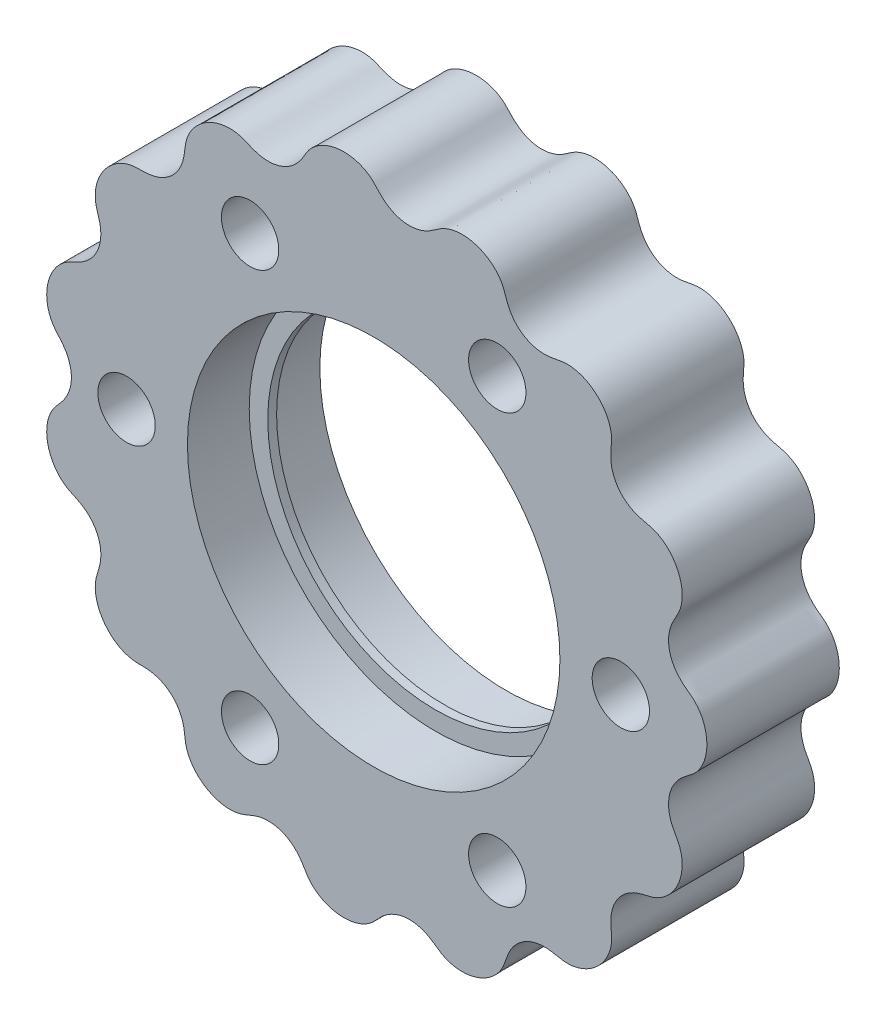
from build123d import *

# Parameters (mm, degrees)
LOBEBASE_DEPTH      = 7.5
LOBEBASE_DEPTH_BACK = 7.5
SKETCH4_R           = 21.1
CUT_EXTRUDE1_DEPTH  = 7
CUT_EXTRUDE2_START  = -7
SKETCH5_R           = 21.1
CUT_EXTRUDE2_DEPTH  = 7
SKETCH6_R           = 19
CUT_EXTRUDE3_DEPTH  = 56.333581379
SKETCH7_R           = 4.1
CUT_EXTRUDE4_DEPTH  = 5
SKETCH8_R           = 3.25
CUT_EXTRUDE5_DEPTH  = 32
CIRPATTERN1_COUNT   = 6


with BuildPart() as part:
    # LobeBaseSketch → LobeBase (new, two sides: drawn at the far end of the back side and taken through both)
    with BuildSketch(Plane.XY.offset(-LOBEBASE_DEPTH_BACK)):
        with BuildLine():
            add(Edge.make_bspline(
                [(37.75, 0), (37.75, 0.091408208), (37.745431022, 0.273870688), (37.724960683, 0.545998683), (37.691185975, 0.814669547), (37.644613685, 1.07822502), (37.585939314, 1.335090295), (37.516033044, 1.583800342), (37.435921645, 1.823025014), (37.346766209, 2.051592696), (37.249835561, 2.268512363), (37.146475055, 2.472993938), (37.038070263, 2.664467038), (36.92600482, 2.842598332), (36.811611208, 3.007308039), (36.696112656, 3.158786542), (36.580553327, 3.297512757), (36.465712469, 3.424277111), (36.351995924, 3.540213908), (36.239294879, 3.646851346), (36.126796411, 3.746193712), (36.012722585, 3.840861808), (35.893964269, 3.934339571), (35.765565167, 4.031416565), (35.620014788, 4.138994755), (35.446381301, 4.267567909), (35.22964363, 4.433878295), (34.951701851, 4.665260078), (34.598406594, 5.004694966), (34.180160085, 5.509113655), (33.762947862, 6.222046747), (33.46535546, 7.113280892), (33.374722063, 8.048505531), (33.465888381, 8.869497817), (33.642810015, 9.5004234), (33.827500686, 9.954210728), (33.987301686, 10.278637611), (34.117656872, 10.518724861), (34.223983543, 10.706805384), (34.313194439, 10.864283623), (34.391008085, 11.005192489), (34.461478373, 11.138892034), (34.527185015, 11.271773648), (34.589551299, 11.408284664), (34.649135474, 11.551542457), (34.705864963, 11.703708676), (34.759217599, 11.866223661), (34.808361264, 12.039958578), (34.852262584, 12.22531857), (34.889772875, 12.422316449), (34.919697227, 12.630628605), (34.940850806, 12.849640187), (34.952105178, 13.078483907), (34.952426554, 13.316075129), (34.940907246, 13.56114488), (34.916791211, 13.812271733), (34.879494276, 14.067913109), (34.828619462, 14.326436231), (34.763967698, 14.586148793), (34.685544143, 14.845329252), (34.593560301, 15.102256583), (34.488432059, 15.355239264), (34.370773813, 15.602643228), (34.241388801, 15.842918485), (34.101255784, 16.074624121), (33.951512212, 16.296451369), (33.793433987, 16.507244458), (33.628411942, 16.706018951), (33.457925097, 16.891977321), (33.283510701, 17.064521506), (33.106730971, 17.223262236), (32.929136301, 17.368024944), (32.75222447, 17.498852124), (32.577395069, 17.616002036), (32.405897831, 17.719943768), (32.238772795, 17.811348773), (32.07677906, 17.891079263), (31.920307008, 17.960174278), (31.769266032, 18.019835126), (31.62293515, 18.071413629), (31.479756505, 18.116410146), (31.337039897, 18.15649575), (31.190527945, 18.193588578), (31.033744758, 18.230048204), (30.857021878, 18.269125099), (30.646104382, 18.315959418), (30.380460139, 18.379736363), (30.032436239, 18.478065034), (29.571624355, 18.644456107), (28.984371592, 18.935149328), (28.313253249, 19.416750616), (27.678891478, 20.109891787), (27.215703619, 20.927398084), (26.965060549, 21.71449254), (26.87006595, 22.362832252), (26.854217339, 22.852508067), (26.868246515, 23.213883695), (26.889679622, 23.486234543), (26.910314629, 23.701301603), (26.927760666, 23.881450473), (26.94153417, 24.041826789), (26.951531478, 24.19263025), (26.957509661, 24.340748943), (26.958960064, 24.490824615), (26.955124722, 24.645932188), (26.945058112, 24.808016909), (26.927697371, 24.978182207), (26.901927986, 25.156885481), (26.866641137, 25.344076535), (26.820782237, 25.539299862), (26.763391305, 25.741773817), (26.693636026, 25.950454788), (26.61083828, 26.164091494), (26.514494815, 26.381272591), (26.404292556, 26.600469625), (26.280118968, 26.820076546), (26.142067808, 27.038446533), (25.990440526, 27.253926506), (25.825743584, 27.464889496), (25.648681913, 27.669764893), (25.460148731, 27.86706649), (25.261211977, 28.055418161), (25.053097563, 28.233577009), (24.837169721, 28.400453753), (24.614908668, 28.555130151), (24.387885837, 28.696873229), (24.15773692, 28.82514609), (23.92613291, 28.939615113), (23.694749345, 29.04015329), (23.465233823, 29.126839521), (23.239171832, 29.1999536), (23.018050729, 29.259966655), (22.803221522, 29.307526707), (22.595857755, 29.343438953), (22.39691032, 29.368640239), (22.207056239, 29.38416699), (22.026638286, 29.391115628), (21.855590479, 29.390594148), (21.693341429, 29.383663146), (21.538682649, 29.371264321), (21.389580715, 29.354134684), (21.242898322, 29.332706631), (21.093965982, 29.307000836), (20.935907947, 29.276538895), (20.758569559, 29.240357743), (20.546837604, 29.197355148), (20.278219092, 29.147571039), (19.920289566, 29.095844677), (19.431639616, 29.060421407), (18.776921937, 29.087125662), (17.967939932, 29.254121909), (17.106495704, 29.629319699), (16.350842772, 30.187753389), (15.801728778, 30.804854233), (15.451243375, 31.358504248), (15.237595852, 31.799399153), (15.103427432, 32.135238397), (15.012232479, 32.392760907), (14.943607842, 32.597627456), (14.886272444, 32.769297581), (14.833624241, 32.921410825), (14.781419943, 33.063242912), (14.726635985, 33.200987618), (14.666919719, 33.338678498), (14.600328026, 33.478816343), (14.525205925, 33.622793644), (14.440133637, 33.77118613), (14.343906963, 33.923958341), (14.235533361, 34.080613423), (14.11423469, 34.240306312), (13.979451889, 34.401932479), (13.830849072, 34.564200004), (13.668315691, 34.725689969), (13.491966046, 34.884908357), (13.302135807, 35.040331514), (13.099375408, 35.190446471), (12.884440322, 35.333786915), (12.658278306, 35.468965294), (12.422013786, 35.594701294), (12.176929568, 35.709846813), (11.924446148, 35.813407437), (11.666098853, 35.904560383), (11.403513144, 35.982668831), (11.138378358, 36.047292557), (10.872420223, 36.098194763), (10.607372444, 36.135345004), (10.344947673, 36.158918096), (10.086808136, 36.169288914), (9.83453617, 36.167022935), (9.589604841, 36.152862374), (9.353348761, 36.127707713), (9.126935074, 36.092594312), (8.911334411, 36.04866367), (8.707291357, 35.997128698), (8.515293546, 35.939232006), (8.335537914, 35.876195787), (8.167891646, 35.809161092), (8.011843804, 35.739113286), (7.866441014, 35.666788866), (7.730196245, 35.592556582), (7.600952102, 35.51626266), (7.475666642, 35.437026056), (7.350065668, 35.352966403), (7.218062456, 35.260850041), (7.070771977, 35.155666894), (6.894835943, 35.030262924), (6.669689743, 34.875525885), (6.363743857, 34.682688448), (5.931747856, 34.45157584), (5.322771896, 34.20967372), (4.515806567, 34.033189758), (3.576231416, 34.025569062), (2.658772668, 34.228371886), (1.906134546, 34.568776776), (1.360760451, 34.932005976), (0.986255612, 35.247885238), (0.727088535, 35.50011844), (0.539033959, 35.69828463), (0.393015501, 35.857527381), (0.270812478, 35.991035437), (0.160845922, 36.108583847), (0.055466615, 36.216920505), (-0.05060684, 36.320473912), (-0.16116429, 36.421971997), (-0.278998025, 36.522909007), (-0.406186323, 36.623883905), (-0.544260388, 36.724845169), (-0.694305885, 36.825270614), (-0.857027459, 36.924302638), (-1.032792258, 37.020852737), (-1.221661758, 37.113684484), (-1.423417335, 37.201481034), (-1.637582853, 37.282901176), (-1.863446223, 37.356626547), (-2.100081069, 37.421401753), (-2.346369164, 37.476068506), (-2.601023947, 37.519594542), (-2.862615229, 37.551097757), (-3.129595047, 37.569865871), (-3.400324522, 37.575371805), (-3.673101505, 37.567284884), (-3.946188746, 37.545477932), (-4.217842295, 37.510030319), (-4.486339812, 37.461226998), (-4.75000845, 37.399553559), (-5.007252009, 37.325687348), (-5.256577007, 37.240484669), (-5.4966174, 37.144964074), (-5.726157652, 37.040285746), (-5.944153937, 36.927726884), (-6.149753283, 36.808652953), (-6.342310572, 36.684484522), (-6.521403376, 36.556659194), (-6.686844819, 36.426587867), (-6.838694841, 36.295604062), (-6.977270643, 36.164904408), (-7.103157662, 36.035477287), (-7.217223449, 35.908015056), (-7.320638516, 35.782802768), (-7.414911317, 35.659572463), (-7.501950183, 35.537306168), (-7.584175715, 35.41396174), (-7.664727773, 35.286082908), (-7.747851608, 35.14823988), (-7.839626316, 34.992241859), (-7.949345491, 34.80612), (-8.092089555, 34.573185471), (-8.293150978, 34.272580304), (-8.593796996, 33.885739828), (-9.051733762, 33.417058407), (-9.717150779, 32.927609916), (-10.572395774, 32.538488421), (-11.493023385, 32.350593928), (-12.319047664, 32.355443766), (-12.965010318, 32.465446524), (-13.435617182, 32.601691747), (-13.774970575, 32.726705497), (-14.027368429, 32.831250633), (-14.22553279, 32.917335067), (-14.391473425, 32.989596298), (-14.539744119, 33.052254685), (-14.680077395, 33.108363522), (-14.819099283, 33.159820305), (-14.96138153, 33.207575653), (-15.110082783, 33.251858903), (-15.267345266, 33.292371921), (-15.434546846, 33.328444844), (-15.612466937, 33.359159051), (-15.801400445, 33.38344448), (-16.001240042, 33.4001574), (-16.211538989, 33.408143274), (-16.431561954, 33.406288027), (-16.660328445, 33.393560064), (-16.896651711, 33.369044634), (-17.139174849, 33.331971666), (-17.386405191, 33.281737837), (-17.636747545, 33.217923418), (-17.888536585, 33.140304277), (-18.140068464, 33.048859327), (-18.389631612, 32.94377365), (-18.635536538, 32.825437486), (-18.87614446, 32.694441256), (-19.109894484, 32.551566798), (-19.335329071, 32.397774967), (-19.551117511, 32.23418978), (-19.756077101, 32.062079257), (-19.949191768, 31.882833124), (-20.129627853, 31.697937494), (-20.296746796, 31.508946652), (-20.450114497, 31.317451938), (-20.589507116, 31.125047701), (-20.714913101, 30.933294089), (-20.826531274, 30.743676236), (-20.924764778, 30.557559069), (-21.010210763, 30.376136441), (-21.083645718, 30.200372509), (-21.14600648, 30.030932087), (-21.198367202, 29.868094809), (-21.241913141, 29.711644995), (-21.277913349, 29.560724307), (-21.307697128, 29.413626593), (-21.33264519, 29.267501714), (-21.354220151, 29.117915114), (-21.374091742, 28.958179733), (-21.394481998, 28.778340312), (-21.419012872, 28.563682724), (-21.454673055, 28.292827202), (-21.516084668, 27.936431669), (-21.633396276, 27.460751557), (-21.86111242, 26.846330111), (-22.269924477, 26.128547182), (-22.892959687, 25.425207529), (-23.657571284, 24.879104385), (-24.414154619, 24.54756059), (-25.049013019, 24.385316428), (-25.534349708, 24.318369577), (-25.89521213, 24.29454786), (-26.168311381, 24.287395138), (-26.384357227, 24.285436475), (-26.565342831, 24.283956257), (-26.726280312, 24.280890419), (-26.877302658, 24.275069706), (-27.025234832, 24.26553252), (-27.174639982, 24.251287798), (-27.328496957, 24.231260311), (-27.488641513, 24.20430638), (-27.656059937, 24.169253626), (-27.831090621, 24.12494583), (-28.013567743, 24.070285492), (-28.202928056, 24.004271418), (-28.398293852, 23.926030589), (-28.598540235, 23.834844334), (-28.802351895, 23.730169047), (-29.008272617, 23.611651755), (-29.214749594, 23.479140866), (-29.420173811, 23.332692341), (-29.622917269, 23.17257156), (-29.821367453, 22.999251117), (-30.013959247, 22.813404766), (-30.199204331, 22.615897746), (-30.375718006, 22.407773737), (-30.542243313, 22.190238668), (-30.697672308, 21.964641656), (-30.841064278, 21.73245332), (-30.971660737, 21.49524175), (-31.088896983, 21.254646388), (-31.19241004, 21.012350085), (-31.282042778, 20.770049555), (-31.357844029, 20.529424432), (-31.420064478, 20.292105042), (-31.469148118, 20.05963894), (-31.505718966, 19.833456089), (-31.530562712, 19.614832359), (-31.544602811, 19.404850701), (-31.548870372, 19.20435887), (-31.544466911, 19.013921841), (-31.532518673, 18.833765906), (-31.514120685, 18.663709627), (-31.490268007, 18.503073881), (-31.46177086, 18.350558368), (-31.429149665, 18.204063765), (-31.392506512, 18.060424755), (-31.351373867, 17.914995269), (-31.304557236, 17.760987232), (-31.25003738, 17.588402282), (-31.185138341, 17.382325213), (-31.107548674, 17.120382078), (-31.018691851, 16.769820204), (-30.932384806, 16.287549869), (-30.890506139, 15.633627448), (-30.972025917, 14.811621269), (-31.255122894, 13.915677275), (-31.731510185, 13.105791674), (-32.287832445, 12.49518118), (-32.801813806, 12.088743588), (-33.217961196, 11.830180381), (-33.537936258, 11.66164219), (-33.784515564, 11.544028381), (-33.981086605, 11.454365291), (-34.145823122, 11.379399568), (-34.291599838, 11.311139614), (-34.42719812, 11.244395805), (-34.558461762, 11.175513717), (-34.689156308, 11.101731967), (-34.821565736, 11.020856677), (-34.956901916, 10.931096377), (-35.095589017, 10.830978885), (-35.2374659, 10.719310306), (-35.381934683, 10.595155471), (-35.528073594, 10.457828835), (-35.674725717, 10.306889853), (-35.820571099, 10.142139523), (-35.964187041, 9.963616219), (-36.104099656, 9.771589782), (-36.238828726, 9.56655331), (-36.366927104, 9.349212368), (-36.487015481, 9.120471562), (-36.59781297, 8.881418498), (-36.698163808, 8.633305268), (-36.787060271, 8.377527663), (-36.863661875, 8.11560234), (-36.92731083, 7.849142222), (-36.977543711, 7.579830428), (-37.014099289, 7.30939306), (-37.036922453, 7.039571142), (-37.046164144, 6.772092065), (-37.042177242, 6.508640825), (-37.025508318, 6.250831358), (-36.996885151, 6.000178224), (-36.957199868, 5.758068836), (-36.907487523, 5.525736369), (-36.848899801, 5.30423335), (-36.782673411, 5.094405773), (-36.710092445, 4.896867359), (-36.632443681, 4.711973184), (-36.550963201, 4.539791351), (-36.466771923, 4.380070502), (-36.380796404, 4.232199496), (-36.293669455, 4.095153197), (-36.205602367, 3.967414178), (-36.1162167, 3.846852934), (-36.024318265, 3.730536282), (-35.927590223, 3.614409989), (-35.822180391, 3.492758686), (-35.702177401, 3.357269712), (-35.559070084, 3.195405759), (-35.381646524, 2.987667358), (-35.157885418, 2.703554477), (-34.882882991, 2.298082841), (-34.578650715, 1.717728571), (-34.318782704, 0.93363148), (-34.212991408, 0), (-34.318782704, -0.93363148), (-34.578650715, -1.717728571), (-34.882882991, -2.298082841), (-35.157885418, -2.703554477), (-35.381646524, -2.987667358), (-35.559070084, -3.195405759), (-35.702177401, -3.357269712), (-35.822180391, -3.492758686), (-35.927590223, -3.614409989), (-36.024318265, -3.730536282), (-36.1162167, -3.846852934), (-36.205602367, -3.967414178), (-36.293669455, -4.095153197), (-36.380796404, -4.232199496), (-36.466771923, -4.380070502), (-36.550963201, -4.539791351), (-36.632443681, -4.711973184), (-36.710092445, -4.896867359), (-36.782673411, -5.094405773), (-36.848899801, -5.30423335), (-36.907487523, -5.525736369), (-36.957199868, -5.758068836), (-36.996885151, -6.000178224), (-37.025508318, -6.250831358), (-37.042177242, -6.508640825), (-37.046164144, -6.772092065), (-37.036922453, -7.039571142), (-37.014099289, -7.30939306), (-36.977543711, -7.579830428), (-36.92731083, -7.849142222), (-36.863661875, -8.11560234), (-36.787060271, -8.377527663), (-36.698163808, -8.633305268), (-36.59781297, -8.881418498), (-36.487015481, -9.120471562), (-36.366927104, -9.349212368), (-36.238828726, -9.56655331), (-36.104099656, -9.771589782), (-35.964187041, -9.963616219), (-35.820571099, -10.142139523), (-35.674725717, -10.306889853), (-35.528073594, -10.457828835), (-35.381934683, -10.595155471), (-35.2374659, -10.719310306), (-35.095589017, -10.830978885), (-34.956901916, -10.931096377), (-34.821565736, -11.020856677), (-34.689156308, -11.101731967), (-34.558461762, -11.175513717), (-34.42719812, -11.244395805), (-34.291599838, -11.311139614), (-34.145823122, -11.379399568), (-33.981086605, -11.454365291), (-33.784515564, -11.544028381), (-33.537936258, -11.66164219), (-33.217961196, -11.830180381), (-32.801813806, -12.088743588), (-32.287832445, -12.49518118), (-31.731510185, -13.105791674), (-31.255122894, -13.915677275), (-30.972025917, -14.811621269), (-30.890506139, -15.633627448), (-30.932384806, -16.287549869), (-31.018691851, -16.769820204), (-31.107548674, -17.120382078), (-31.185138341, -17.382325213), (-31.25003738, -17.588402282), (-31.304557236, -17.760987232), (-31.351373867, -17.914995269), (-31.392506512, -18.060424755), (-31.429149665, -18.204063765), (-31.46177086, -18.350558368), (-31.490268007, -18.503073881), (-31.514120685, -18.663709627), (-31.532518673, -18.833765906), (-31.544466911, -19.013921841), (-31.548870372, -19.20435887), (-31.544602811, -19.404850701), (-31.530562712, -19.614832359), (-31.505718966, -19.833456089), (-31.469148118, -20.05963894), (-31.420064478, -20.292105042), (-31.357844029, -20.529424432), (-31.282042778, -20.770049555), (-31.19241004, -21.012350085), (-31.088896983, -21.254646388), (-30.971660737, -21.49524175), (-30.841064278, -21.73245332), (-30.697672308, -21.964641656), (-30.542243313, -22.190238668), (-30.375718006, -22.407773737), (-30.199204331, -22.615897746), (-30.013959247, -22.813404766), (-29.821367453, -22.999251117), (-29.622917269, -23.17257156), (-29.420173811, -23.332692341), (-29.214749594, -23.479140866), (-29.008272617, -23.611651755), (-28.802351895, -23.730169047), (-28.598540235, -23.834844334), (-28.398293852, -23.926030589), (-28.202928056, -24.004271418), (-28.013567743, -24.070285492), (-27.831090621, -24.12494583), (-27.656059937, -24.169253626), (-27.488641513, -24.20430638), (-27.328496957, -24.231260311), (-27.174639982, -24.251287798), (-27.025234832, -24.26553252), (-26.877302658, -24.275069706), (-26.726280312, -24.280890419), (-26.565342831, -24.283956257), (-26.384357227, -24.285436475), (-26.168311381, -24.287395138), (-25.89521213, -24.29454786), (-25.534349708, -24.318369577), (-25.049013019, -24.385316428), (-24.414154619, -24.54756059), (-23.657571284, -24.879104385), (-22.892959687, -25.425207529), (-22.269924477, -26.128547182), (-21.86111242, -26.846330111), (-21.633396276, -27.460751557), (-21.516084668, -27.936431669), (-21.454673055, -28.292827202), (-21.419012872, -28.563682724), (-21.394481998, -28.778340312), (-21.374091742, -28.958179733), (-21.354220151, -29.117915114), (-21.33264519, -29.267501714), (-21.307697128, -29.413626593), (-21.277913349, -29.560724307), (-21.241913141, -29.711644995), (-21.198367202, -29.868094809), (-21.14600648, -30.030932087), (-21.083645718, -30.200372509), (-21.010210763, -30.376136441), (-20.924764778, -30.557559069), (-20.826531274, -30.743676236), (-20.714913101, -30.933294089), (-20.589507116, -31.125047701), (-20.450114497, -31.317451938), (-20.296746796, -31.508946652), (-20.129627853, -31.697937494), (-19.949191768, -31.882833124), (-19.756077101, -32.062079257), (-19.551117511, -32.23418978), (-19.335329071, -32.397774967), (-19.109894484, -32.551566798), (-18.87614446, -32.694441256), (-18.635536538, -32.825437486), (-18.389631612, -32.94377365), (-18.140068464, -33.048859327), (-17.888536585, -33.140304277), (-17.636747545, -33.217923418), (-17.386405191, -33.281737837), (-17.139174849, -33.331971666), (-16.896651711, -33.369044634), (-16.660328445, -33.393560064), (-16.431561954, -33.406288027), (-16.211538989, -33.408143274), (-16.001240042, -33.4001574), (-15.801400445, -33.38344448), (-15.612466937, -33.359159051), (-15.434546846, -33.328444844), (-15.267345266, -33.292371921), (-15.110082783, -33.251858903), (-14.96138153, -33.207575653), (-14.819099283, -33.159820305), (-14.680077395, -33.108363522), (-14.539744119, -33.052254685), (-14.391473425, -32.989596298), (-14.22553279, -32.917335067), (-14.027368429, -32.831250633), (-13.774970575, -32.726705497), (-13.435617182, -32.601691747), (-12.965010318, -32.465446524), (-12.319047664, -32.355443766), (-11.493023385, -32.350593928), (-10.572395774, -32.538488421), (-9.717150779, -32.927609916), (-9.051733762, -33.417058407), (-8.593796996, -33.885739828), (-8.293150978, -34.272580304), (-8.092089555, -34.573185471), (-7.949345491, -34.80612), (-7.839626316, -34.992241859), (-7.747851608, -35.14823988), (-7.664727773, -35.286082908), (-7.584175715, -35.41396174), (-7.501950183, -35.537306168), (-7.414911317, -35.659572463), (-7.320638516, -35.782802768), (-7.217223449, -35.908015056), (-7.103157662, -36.035477287), (-6.977270643, -36.164904408), (-6.838694841, -36.295604062), (-6.686844819, -36.426587867), (-6.521403376, -36.556659194), (-6.342310572, -36.684484522), (-6.149753283, -36.808652953), (-5.944153937, -36.927726884), (-5.726157652, -37.040285746), (-5.4966174, -37.144964074), (-5.256577007, -37.240484669), (-5.007252009, -37.325687348), (-4.75000845, -37.399553559), (-4.486339812, -37.461226998), (-4.217842295, -37.510030319), (-3.946188746, -37.545477932), (-3.673101505, -37.567284884), (-3.400324522, -37.575371805), (-3.129595047, -37.569865871), (-2.862615229, -37.551097757), (-2.601023947, -37.519594542), (-2.346369164, -37.476068506), (-2.100081069, -37.421401753), (-1.863446223, -37.356626547), (-1.637582853, -37.282901176), (-1.423417335, -37.201481034), (-1.221661758, -37.113684484), (-1.032792258, -37.020852737), (-0.857027459, -36.924302638), (-0.694305885, -36.825270614), (-0.544260388, -36.724845169), (-0.406186323, -36.623883905), (-0.278998025, -36.522909007), (-0.16116429, -36.421971997), (-0.05060684, -36.320473912), (0.055466615, -36.216920505), (0.160845922, -36.108583847), (0.270812478, -35.991035437), (0.393015501, -35.857527381), (0.539033959, -35.69828463), (0.727088535, -35.50011844), (0.986255612, -35.247885238), (1.360760451, -34.932005976), (1.906134546, -34.568776776), (2.658772668, -34.228371886), (3.576231416, -34.025569062), (4.515806567, -34.033189758), (5.322771896, -34.20967372), (5.931747856, -34.45157584), (6.363743857, -34.682688448), (6.669689743, -34.875525885), (6.894835943, -35.030262924), (7.070771977, -35.155666894), (7.218062456, -35.260850041), (7.350065668, -35.352966403), (7.475666642, -35.437026056), (7.600952102, -35.51626266), (7.730196245, -35.592556582), (7.866441014, -35.666788866), (8.011843804, -35.739113286), (8.167891646, -35.809161092), (8.335537914, -35.876195787), (8.515293546, -35.939232006), (8.707291357, -35.997128698), (8.911334411, -36.04866367), (9.126935074, -36.092594312), (9.353348761, -36.127707713), (9.589604841, -36.152862374), (9.83453617, -36.167022935), (10.086808136, -36.169288914), (10.344947673, -36.158918096), (10.607372444, -36.135345004), (10.872420223, -36.098194763), (11.138378358, -36.047292557), (11.403513144, -35.982668831), (11.666098853, -35.904560383), (11.924446148, -35.813407437), (12.176929568, -35.709846813), (12.422013786, -35.594701294), (12.658278306, -35.468965294), (12.884440322, -35.333786915), (13.099375408, -35.190446471), (13.302135807, -35.040331514), (13.491966046, -34.884908357), (13.668315691, -34.725689969), (13.830849072, -34.564200004), (13.979451889, -34.401932479), (14.11423469, -34.240306312), (14.235533361, -34.080613423), (14.343906963, -33.923958341), (14.440133637, -33.77118613), (14.525205925, -33.622793644), (14.600328026, -33.478816343), (14.666919719, -33.338678498), (14.726635985, -33.200987618), (14.781419943, -33.063242912), (14.833624241, -32.921410825), (14.886272444, -32.769297581), (14.943607842, -32.597627456), (15.012232479, -32.392760907), (15.103427432, -32.135238397), (15.237595852, -31.799399153), (15.451243375, -31.358504248), (15.801728778, -30.804854233), (16.350842772, -30.187753389), (17.106495704, -29.629319699), (17.967939932, -29.254121909), (18.776921937, -29.087125662), (19.431639616, -29.060421407), (19.920289566, -29.095844677), (20.278219092, -29.147571039), (20.546837604, -29.197355148), (20.758569559, -29.240357743), (20.935907947, -29.276538895), (21.093965982, -29.307000836), (21.242898322, -29.332706631), (21.389580715, -29.354134684), (21.538682649, -29.371264321), (21.693341429, -29.383663146), (21.855590479, -29.390594148), (22.026638286, -29.391115628), (22.207056239, -29.38416699), (22.39691032, -29.368640239), (22.595857755, -29.343438953), (22.803221522, -29.307526707), (23.018050729, -29.259966655), (23.239171832, -29.1999536), (23.465233823, -29.126839521), (23.694749345, -29.04015329), (23.92613291, -28.939615113), (24.15773692, -28.82514609), (24.387885837, -28.696873229), (24.614908668, -28.555130151), (24.837169721, -28.400453753), (25.053097563, -28.233577009), (25.261211977, -28.055418161), (25.460148731, -27.86706649), (25.648681913, -27.669764893), (25.825743584, -27.464889496), (25.990440526, -27.253926506), (26.142067808, -27.038446533), (26.280118968, -26.820076546), (26.404292556, -26.600469625), (26.514494815, -26.381272591), (26.61083828, -26.164091494), (26.693636026, -25.950454788), (26.763391305, -25.741773817), (26.820782237, -25.539299862), (26.866641137, -25.344076535), (26.901927986, -25.156885481), (26.927697371, -24.978182207), (26.945058112, -24.808016909), (26.955124722, -24.645932188), (26.958960064, -24.490824615), (26.957509661, -24.340748943), (26.951531478, -24.19263025), (26.94153417, -24.041826789), (26.927760666, -23.881450473), (26.910314629, -23.701301603), (26.889679622, -23.486234543), (26.868246515, -23.213883695), (26.854217339, -22.852508067), (26.87006595, -22.362832252), (26.965060549, -21.71449254), (27.215703619, -20.927398084), (27.678891478, -20.109891787), (28.313253249, -19.416750616), (28.984371592, -18.935149328), (29.571624355, -18.644456107), (30.032436239, -18.478065034), (30.380460139, -18.379736363), (30.646104382, -18.315959418), (30.857021878, -18.269125099), (31.033744758, -18.230048204), (31.190527945, -18.193588578), (31.337039897, -18.15649575), (31.479756505, -18.116410146), (31.62293515, -18.071413629), (31.769266032, -18.019835126), (31.920307008, -17.960174278), (32.07677906, -17.891079263), (32.238772795, -17.811348773), (32.405897831, -17.719943768), (32.577395069, -17.616002036), (32.75222447, -17.498852124), (32.929136301, -17.368024944), (33.106730971, -17.223262236), (33.283510701, -17.064521506), (33.457925097, -16.891977321), (33.628411942, -16.706018951), (33.793433987, -16.507244458), (33.951512212, -16.296451369), (34.101255784, -16.074624121), (34.241388801, -15.842918485), (34.370773813, -15.602643228), (34.488432059, -15.355239264), (34.593560301, -15.102256583), (34.685544143, -14.845329252), (34.763967698, -14.586148793), (34.828619462, -14.326436231), (34.879494276, -14.067913109), (34.916791211, -13.812271733), (34.940907246, -13.56114488), (34.952426554, -13.316075129), (34.952105178, -13.078483907), (34.940850806, -12.849640187), (34.919697227, -12.630628605), (34.889772875, -12.422316449), (34.852262584, -12.22531857), (34.808361264, -12.039958578), (34.759217599, -11.866223661), (34.705864963, -11.703708676), (34.649135474, -11.551542457), (34.589551299, -11.408284664), (34.527185015, -11.271773648), (34.461478373, -11.138892034), (34.391008085, -11.005192489), (34.313194439, -10.864283623), (34.223983543, -10.706805384), (34.117656872, -10.518724861), (33.987301686, -10.278637611), (33.827500686, -9.954210728), (33.642810015, -9.5004234), (33.465888381, -8.869497817), (33.374722063, -8.048505531), (33.46535546, -7.113280892), (33.762947862, -6.222046747), (34.180160085, -5.509113655), (34.598406594, -5.004694966), (34.951701851, -4.665260078), (35.22964363, -4.433878295), (35.446381301, -4.267567909), (35.620014788, -4.138994755), (35.765565167, -4.031416565), (35.893964269, -3.934339571), (36.012722585, -3.840861808), (36.126796411, -3.746193712), (36.239294879, -3.646851346), (36.351995924, -3.540213908), (36.465712469, -3.424277111), (36.580553327, -3.297512757), (36.696112656, -3.158786542), (36.811611208, -3.007308039), (36.92600482, -2.842598332), (37.038070263, -2.664467038), (37.146475055, -2.472993938), (37.249835561, -2.268512363), (37.346766209, -2.051592696), (37.435921645, -1.823025014), (37.516033044, -1.583800342), (37.585939314, -1.335090295), (37.644613685, -1.07822502), (37.691185975, -0.814669547), (37.724960683, -0.545998683), (37.745431022, -0.273870688), (37.75, -0.091408208), (37.75, 0)],
                knots=[0, 0, 0, 0, 0.001063028, 0.002121941, 0.003172652, 0.004211139, 0.005233476, 0.006235865, 0.007214682, 0.008166516, 0.009088218, 0.009976968, 0.010830339, 0.011646392, 0.012423789, 0.013161937, 0.013861189, 0.0145231, 0.015150802, 0.01574951, 0.016327272, 0.016896058, 0.017473404, 0.018084918, 0.018768139, 0.019578457, 0.020597772, 0.021945216, 0.023782783, 0.026288616, 0.029542917, 0.033333333, 0.037123749, 0.040378051, 0.042883884, 0.04472145, 0.046068895, 0.047088209, 0.047898528, 0.048581749, 0.049193263, 0.049770609, 0.050339395, 0.050917157, 0.051515865, 0.052143566, 0.052805478, 0.053504729, 0.054242878, 0.055020274, 0.055836328, 0.056689699, 0.057578448, 0.058500151, 0.059451984, 0.060430802, 0.061433191, 0.062455527, 0.063494015, 0.064544726, 0.065603638, 0.066666667, 0.067729695, 0.068788608, 0.069839319, 0.070877806, 0.071900142, 0.072902532, 0.073881349, 0.074833182, 0.075754885, 0.076643635, 0.077497006, 0.078313059, 0.079090456, 0.079828604, 0.080527855, 0.081189767, 0.081817469, 0.082416177, 0.082993938, 0.083562724, 0.084140071, 0.084751584, 0.085434805, 0.086245124, 0.087264438, 0.088611883, 0.09044945, 0.092955282, 0.096209584, 0.1, 0.103790416, 0.107044718, 0.10955055, 0.111388117, 0.112735562, 0.113754876, 0.114565195, 0.115248416, 0.115859929, 0.116437276, 0.117006062, 0.117583823, 0.118182531, 0.118810233, 0.119472145, 0.120171396, 0.120909544, 0.121686941, 0.122502994, 0.123356365, 0.124245115, 0.125166818, 0.126118651, 0.127097468, 0.128099858, 0.129122194, 0.130160681, 0.131211392, 0.132270305, 0.133333333, 0.134396362, 0.135455274, 0.136505985, 0.137544473, 0.138566809, 0.139569198, 0.140548016, 0.141499849, 0.142421552, 0.143310301, 0.144163672, 0.144979726, 0.145757122, 0.146495271, 0.147194522, 0.147856434, 0.148484135, 0.149082843, 0.149660605, 0.150229391, 0.150806737, 0.151418251, 0.152101472, 0.152911791, 0.153931105, 0.15527855, 0.157116116, 0.159621949, 0.162876251, 0.166666667, 0.170457083, 0.173711384, 0.176217217, 0.178054784, 0.179402228, 0.180421543, 0.181231861, 0.181915082, 0.182526596, 0.183103942, 0.183672728, 0.18425049, 0.184849198, 0.1854769, 0.186138811, 0.186838063, 0.187576211, 0.188353608, 0.189169661, 0.190023032, 0.190911782, 0.191833484, 0.192785318, 0.193764135, 0.194766524, 0.195788861, 0.196827348, 0.197878059, 0.198936972, 0.2, 0.201063028, 0.202121941, 0.203172652, 0.204211139, 0.205233476, 0.206235865, 0.207214682, 0.208166516, 0.209088218, 0.209976968, 0.210830339, 0.211646392, 0.212423789, 0.213161937, 0.213861189, 0.2145231, 0.215150802, 0.21574951, 0.216327272, 0.216896058, 0.217473404, 0.218084918, 0.218768139, 0.219578457, 0.220597772, 0.221945216, 0.223782783, 0.226288616, 0.229542917, 0.233333333, 0.237123749, 0.240378051, 0.242883884, 0.24472145, 0.246068895, 0.247088209, 0.247898528, 0.248581749, 0.249193263, 0.249770609, 0.250339395, 0.250917157, 0.251515865, 0.252143566, 0.252805478, 0.253504729, 0.254242878, 0.255020274, 0.255836328, 0.256689699, 0.257578448, 0.258500151, 0.259451984, 0.260430802, 0.261433191, 0.262455527, 0.263494015, 0.264544726, 0.265603638, 0.266666667, 0.267729695, 0.268788608, 0.269839319, 0.270877806, 0.271900142, 0.272902532, 0.273881349, 0.274833182, 0.275754885, 0.276643635, 0.277497006, 0.278313059, 0.279090456, 0.279828604, 0.280527855, 0.281189767, 0.281817469, 0.282416177, 0.282993938, 0.283562724, 0.284140071, 0.284751584, 0.285434805, 0.286245124, 0.287264438, 0.288611883, 0.29044945, 0.292955282, 0.296209584, 0.3, 0.303790416, 0.307044718, 0.30955055, 0.311388117, 0.312735562, 0.313754876, 0.314565195, 0.315248416, 0.315859929, 0.316437276, 0.317006062, 0.317583823, 0.318182531, 0.318810233, 0.319472145, 0.320171396, 0.320909544, 0.321686941, 0.322502994, 0.323356365, 0.324245115, 0.325166818, 0.326118651, 0.327097468, 0.328099858, 0.329122194, 0.330160681, 0.331211392, 0.332270305, 0.333333333, 0.334396362, 0.335455274, 0.336505985, 0.337544473, 0.338566809, 0.339569198, 0.340548016, 0.341499849, 0.342421552, 0.343310301, 0.344163672, 0.344979726, 0.345757122, 0.346495271, 0.347194522, 0.347856434, 0.348484135, 0.349082843, 0.349660605, 0.350229391, 0.350806737, 0.351418251, 0.352101472, 0.352911791, 0.353931105, 0.35527855, 0.357116116, 0.359621949, 0.362876251, 0.366666667, 0.370457083, 0.373711384, 0.376217217, 0.378054784, 0.379402228, 0.380421543, 0.381231861, 0.381915082, 0.382526596, 0.383103942, 0.383672728, 0.38425049, 0.384849198, 0.3854769, 0.386138811, 0.386838063, 0.387576211, 0.388353608, 0.389169661, 0.390023032, 0.390911782, 0.391833484, 0.392785318, 0.393764135, 0.394766524, 0.395788861, 0.396827348, 0.397878059, 0.398936972, 0.4, 0.401063028, 0.402121941, 0.403172652, 0.404211139, 0.405233476, 0.406235865, 0.407214682, 0.408166516, 0.409088218, 0.409976968, 0.410830339, 0.411646392, 0.412423789, 0.413161937, 0.413861189, 0.4145231, 0.415150802, 0.41574951, 0.416327272, 0.416896058, 0.417473404, 0.418084918, 0.418768139, 0.419578457, 0.420597772, 0.421945216, 0.423782783, 0.426288616, 0.429542917, 0.433333333, 0.437123749, 0.440378051, 0.442883884, 0.44472145, 0.446068895, 0.447088209, 0.447898528, 0.448581749, 0.449193263, 0.449770609, 0.450339395, 0.450917157, 0.451515865, 0.452143566, 0.452805478, 0.453504729, 0.454242878, 0.455020274, 0.455836328, 0.456689699, 0.457578448, 0.458500151, 0.459451984, 0.460430802, 0.461433191, 0.462455527, 0.463494015, 0.464544726, 0.465603638, 0.466666667, 0.467729695, 0.468788608, 0.469839319, 0.470877806, 0.471900142, 0.472902532, 0.473881349, 0.474833182, 0.475754885, 0.476643635, 0.477497006, 0.478313059, 0.479090456, 0.479828604, 0.480527855, 0.481189767, 0.481817469, 0.482416177, 0.482993938, 0.483562724, 0.484140071, 0.484751584, 0.485434805, 0.486245124, 0.487264438, 0.488611883, 0.49044945, 0.492955282, 0.496209584, 0.5, 0.503790416, 0.507044718, 0.50955055, 0.511388117, 0.512735562, 0.513754876, 0.514565195, 0.515248416, 0.515859929, 0.516437276, 0.517006062, 0.517583823, 0.518182531, 0.518810233, 0.519472145, 0.520171396, 0.520909544, 0.521686941, 0.522502994, 0.523356365, 0.524245115, 0.525166818, 0.526118651, 0.527097468, 0.528099858, 0.529122194, 0.530160681, 0.531211392, 0.532270305, 0.533333333, 0.534396362, 0.535455274, 0.536505985, 0.537544473, 0.538566809, 0.539569198, 0.540548016, 0.541499849, 0.542421552, 0.543310301, 0.544163672, 0.544979726, 0.545757122, 0.546495271, 0.547194522, 0.547856434, 0.548484135, 0.549082843, 0.549660605, 0.550229391, 0.550806737, 0.551418251, 0.552101472, 0.552911791, 0.553931105, 0.55527855, 0.557116116, 0.559621949, 0.562876251, 0.566666667, 0.570457083, 0.573711384, 0.576217217, 0.578054784, 0.579402228, 0.580421543, 0.581231861, 0.581915082, 0.582526596, 0.583103942, 0.583672728, 0.58425049, 0.584849198, 0.5854769, 0.586138811, 0.586838063, 0.587576211, 0.588353608, 0.589169661, 0.590023032, 0.590911782, 0.591833484, 0.592785318, 0.593764135, 0.594766524, 0.595788861, 0.596827348, 0.597878059, 0.598936972, 0.6, 0.601063028, 0.602121941, 0.603172652, 0.604211139, 0.605233476, 0.606235865, 0.607214682, 0.608166516, 0.609088218, 0.609976968, 0.610830339, 0.611646392, 0.612423789, 0.613161937, 0.613861189, 0.6145231, 0.615150802, 0.61574951, 0.616327272, 0.616896058, 0.617473404, 0.618084918, 0.618768139, 0.619578457, 0.620597772, 0.621945216, 0.623782783, 0.626288616, 0.629542917, 0.633333333, 0.637123749, 0.640378051, 0.642883884, 0.64472145, 0.646068895, 0.647088209, 0.647898528, 0.648581749, 0.649193263, 0.649770609, 0.650339395, 0.650917157, 0.651515865, 0.652143566, 0.652805478, 0.653504729, 0.654242878, 0.655020274, 0.655836328, 0.656689699, 0.657578448, 0.658500151, 0.659451984, 0.660430802, 0.661433191, 0.662455527, 0.663494015, 0.664544726, 0.665603638, 0.666666667, 0.667729695, 0.668788608, 0.669839319, 0.670877806, 0.671900142, 0.672902532, 0.673881349, 0.674833182, 0.675754885, 0.676643635, 0.677497006, 0.678313059, 0.679090456, 0.679828604, 0.680527855, 0.681189767, 0.681817469, 0.682416177, 0.682993938, 0.683562724, 0.684140071, 0.684751584, 0.685434805, 0.686245124, 0.687264438, 0.688611883, 0.69044945, 0.692955282, 0.696209584, 0.7, 0.703790416, 0.707044718, 0.70955055, 0.711388117, 0.712735562, 0.713754876, 0.714565195, 0.715248416, 0.715859929, 0.716437276, 0.717006062, 0.717583823, 0.718182531, 0.718810233, 0.719472145, 0.720171396, 0.720909544, 0.721686941, 0.722502994, 0.723356365, 0.724245115, 0.725166818, 0.726118651, 0.727097468, 0.728099858, 0.729122194, 0.730160681, 0.731211392, 0.732270305, 0.733333333, 0.734396362, 0.735455274, 0.736505985, 0.737544473, 0.738566809, 0.739569198, 0.740548016, 0.741499849, 0.742421552, 0.743310301, 0.744163672, 0.744979726, 0.745757122, 0.746495271, 0.747194522, 0.747856434, 0.748484135, 0.749082843, 0.749660605, 0.750229391, 0.750806737, 0.751418251, 0.752101472, 0.752911791, 0.753931105, 0.75527855, 0.757116116, 0.759621949, 0.762876251, 0.766666667, 0.770457083, 0.773711384, 0.776217217, 0.778054784, 0.779402228, 0.780421543, 0.781231861, 0.781915082, 0.782526596, 0.783103942, 0.783672728, 0.78425049, 0.784849198, 0.7854769, 0.786138811, 0.786838063, 0.787576211, 0.788353608, 0.789169661, 0.790023032, 0.790911782, 0.791833484, 0.792785318, 0.793764135, 0.794766524, 0.795788861, 0.796827348, 0.797878059, 0.798936972, 0.8, 0.801063028, 0.802121941, 0.803172652, 0.804211139, 0.805233476, 0.806235865, 0.807214682, 0.808166516, 0.809088218, 0.809976968, 0.810830339, 0.811646392, 0.812423789, 0.813161937, 0.813861189, 0.8145231, 0.815150802, 0.81574951, 0.816327272, 0.816896058, 0.817473404, 0.818084918, 0.818768139, 0.819578457, 0.820597772, 0.821945216, 0.823782783, 0.826288616, 0.829542917, 0.833333333, 0.837123749, 0.840378051, 0.842883884, 0.84472145, 0.846068895, 0.847088209, 0.847898528, 0.848581749, 0.849193263, 0.849770609, 0.850339395, 0.850917157, 0.851515865, 0.852143566, 0.852805478, 0.853504729, 0.854242878, 0.855020274, 0.855836328, 0.856689699, 0.857578448, 0.858500151, 0.859451984, 0.860430802, 0.861433191, 0.862455527, 0.863494015, 0.864544726, 0.865603638, 0.866666667, 0.867729695, 0.868788608, 0.869839319, 0.870877806, 0.871900142, 0.872902532, 0.873881349, 0.874833182, 0.875754885, 0.876643635, 0.877497006, 0.878313059, 0.879090456, 0.879828604, 0.880527855, 0.881189767, 0.881817469, 0.882416177, 0.882993938, 0.883562724, 0.884140071, 0.884751584, 0.885434805, 0.886245124, 0.887264438, 0.888611883, 0.89044945, 0.892955282, 0.896209584, 0.9, 0.903790416, 0.907044718, 0.90955055, 0.911388117, 0.912735562, 0.913754876, 0.914565195, 0.915248416, 0.915859929, 0.916437276, 0.917006062, 0.917583823, 0.918182531, 0.918810233, 0.919472145, 0.920171396, 0.920909544, 0.921686941, 0.922502994, 0.923356365, 0.924245115, 0.925166818, 0.926118651, 0.927097468, 0.928099858, 0.929122194, 0.930160681, 0.931211392, 0.932270305, 0.933333333, 0.934396362, 0.935455274, 0.936505985, 0.937544473, 0.938566809, 0.939569198, 0.940548016, 0.941499849, 0.942421552, 0.943310301, 0.944163672, 0.944979726, 0.945757122, 0.946495271, 0.947194522, 0.947856434, 0.948484135, 0.949082843, 0.949660605, 0.950229391, 0.950806737, 0.951418251, 0.952101472, 0.952911791, 0.953931105, 0.95527855, 0.957116116, 0.959621949, 0.962876251, 0.966666667, 0.970457083, 0.973711384, 0.976217217, 0.978054784, 0.979402228, 0.980421543, 0.981231861, 0.981915082, 0.982526596, 0.983103942, 0.983672728, 0.98425049, 0.984849198, 0.9854769, 0.986138811, 0.986838063, 0.987576211, 0.988353608, 0.989169661, 0.990023032, 0.990911782, 0.991833484, 0.992785318, 0.993764135, 0.994766524, 0.995788861, 0.996827348, 0.997878059, 0.998936972, 1, 1, 1, 1], degree=3))
        make_face()
    extrude(amount=LOBEBASE_DEPTH + LOBEBASE_DEPTH_BACK)

    # Sketch4 → Cut-Extrude1 (cut)
    with BuildSketch(Plane.XY.offset(7.5)):
        Circle(SKETCH4_R)
    extrude(amount=-CUT_EXTRUDE1_DEPTH, mode=Mode.SUBTRACT)

    # Sketch5 → Cut-Extrude2 (cut)
    with BuildSketch(Plane(origin=(0, 0, -7.5), x_dir=(-1, 0, 0), z_dir=(0, 0, -1)).offset(CUT_EXTRUDE2_START)):
        Circle(SKETCH5_R)
    extrude(amount=CUT_EXTRUDE2_DEPTH, mode=Mode.SUBTRACT)

    # Sketch6 → Cut-Extrude3 (cut, through all)
    with BuildSketch(Plane(origin=(0, 0, -7.5), x_dir=(-1, 0, 0), z_dir=(0, 0, -1))):
        Circle(SKETCH6_R)
    extrude(amount=-CUT_EXTRUDE3_DEPTH, mode=Mode.SUBTRACT)

    # Sketch7 → Cut-Extrude4 (cut)
    with BuildSketch(Plane(origin=(0, 0, -7.5), x_dir=(-1, 0, 0), z_dir=(0, 0, -1))):
        with Locations((-28, 0)):
            Circle(SKETCH7_R)
    cut_extrude4 = extrude(amount=-CUT_EXTRUDE4_DEPTH, mode=Mode.SUBTRACT)

    # Sketch8 → Cut-Extrude5 (cut)
    with BuildSketch(Plane(origin=(0, 0, -7.5), x_dir=(-1, 0, 0), z_dir=(0, 0, -1))):
        with Locations((-28, 0)):
            Circle(SKETCH8_R)
    cut_extrude5 = extrude(amount=-CUT_EXTRUDE5_DEPTH, mode=Mode.SUBTRACT)

    # CirPattern1: Cut-Extrude4, Cut-Extrude5 ×6 about axis
    cirpattern1_axis = Axis((0, 0, -7.5), (0, 0, -1))
    add([cut_extrude4.rotate(cirpattern1_axis, i * 360 / CIRPATTERN1_COUNT) for i in range(1, CIRPATTERN1_COUNT)], mode=Mode.SUBTRACT)
    add([cut_extrude5.rotate(cirpattern1_axis, i * 360 / CIRPATTERN1_COUNT) for i in range(1, CIRPATTERN1_COUNT)], mode=Mode.SUBTRACT)


solid = part.part
